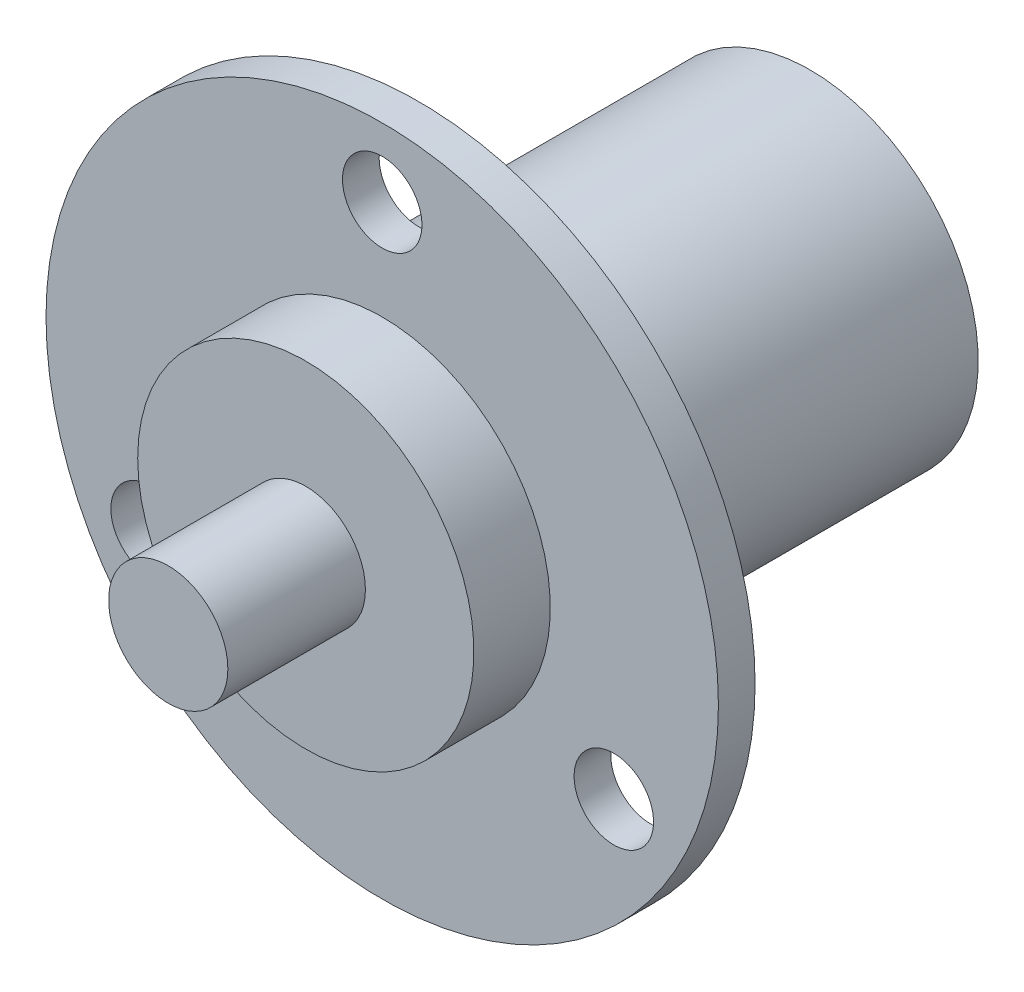
from build123d import *

# Parameters (mm, degrees)
SKETCH1_R           = 3.9
BOSS_EXTRUDE1_DEPTH = 9
SKETCH2_R           = 11
BOSS_EXTRUDE2_DEPTH = 5
SKETCH3_R           = 22
SKETCH3_R_2         = 2.6
SKETCH3_R_3         = 11
BOSS_EXTRUDE3_DEPTH = 2.4
SKETCH4_R           = 11
BOSS_EXTRUDE4_DEPTH = 25.6


with BuildPart() as part:
    # Sketch1 → Boss-Extrude1 (new body)
    with BuildSketch(Plane.XY):
        Circle(SKETCH1_R)
    extrude(amount=-BOSS_EXTRUDE1_DEPTH)

    # Sketch2 → Boss-Extrude2 (add)
    with BuildSketch(Plane(origin=(0, 0, -9), x_dir=(-1, 0, 0), z_dir=(0, 0, -1))):
        Circle(SKETCH2_R)
    extrude(amount=BOSS_EXTRUDE2_DEPTH)


with BuildPart() as body_2:
    # Sketch3 → Boss-Extrude3 (new body)
    # profile 1 of 2: a face of its own
    with BuildSketch(Plane(origin=(0, 0, -14), x_dir=(-1, 0, 0), z_dir=(0, 0, -1))):
        Circle(SKETCH3_R)
        with Locations((-15.155444566, -8.75)):
            Circle(SKETCH3_R_2, mode=Mode.SUBTRACT)
        with Locations((15.155444566, -8.75)):
            Circle(SKETCH3_R_2, mode=Mode.SUBTRACT)
        with Locations((0, 17.5)):
            Circle(SKETCH3_R_2, mode=Mode.SUBTRACT)
        Circle(SKETCH3_R_3, mode=Mode.SUBTRACT)
    # profile 2 of 2: a face of its own
    with BuildSketch(Plane(origin=(0, 0, -14), x_dir=(-1, 0, 0), z_dir=(0, 0, -1))):
        Circle(SKETCH3_R_3)
    extrude(amount=BOSS_EXTRUDE3_DEPTH)

    # Sketch4 → Boss-Extrude4 (add)
    with BuildSketch(Plane(origin=(0, 0, -16.4), x_dir=(-1, 0, 0), z_dir=(0, 0, -1))):
        Circle(SKETCH4_R)
    extrude(amount=BOSS_EXTRUDE4_DEPTH)


solid = Compound([part.part, body_2.part])
